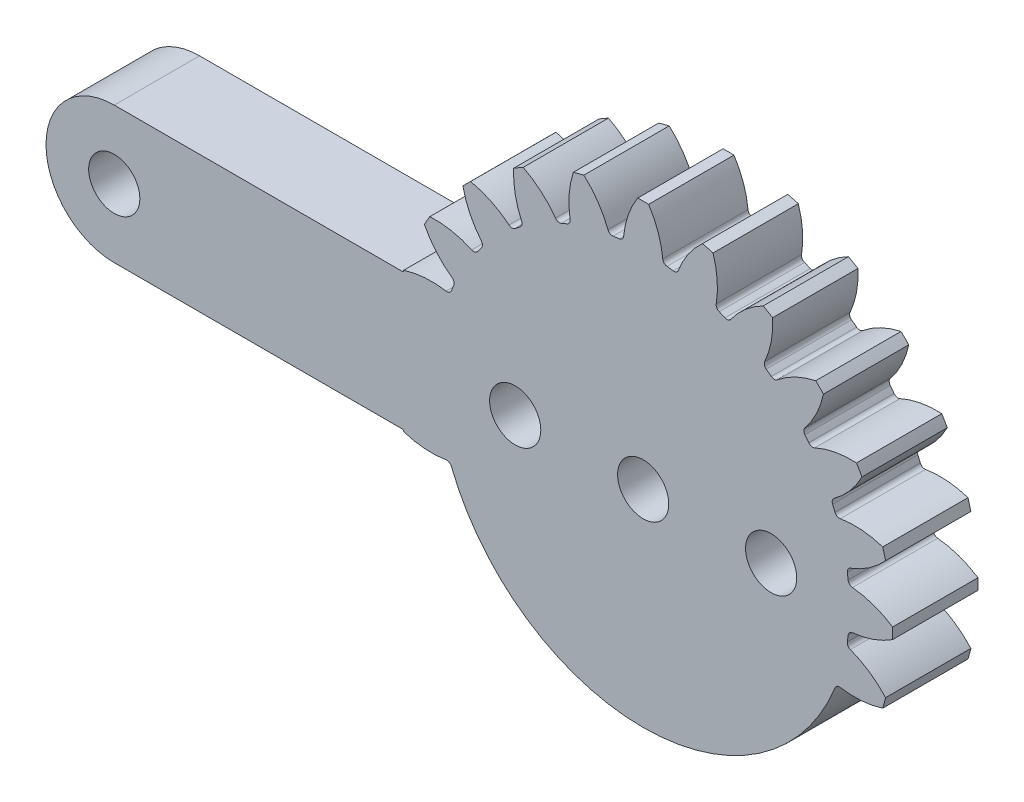
from build123d import *

# Parameters (mm, degrees)
SKETCH_1_R                       = 12.09375
SKETCH_1_R_2                     = 1.5
EXTRUDE_2_DEPTH                  = 5
EXTRUDE_3_DEPTH                  = 5
FILLET_2_R                       = 0.28125
PATTERN_CIRCULAR_1_COUNT         = 24
FILLET_2_OF_PATTERN_CIRCULAR_1_R = 0.28125
EXTRUDE_START                    = -5
SKETCH_2_R                       = 1.5
EXTRUDE_4_DEPTH                  = 5
CUT_EXTRUDE_1_DEPTH              = 5
CUT_EXTRUDE_1_DEPTH_BACK         = 39.260823775
CUT_EXTRUDE_2_REACH              = 40.261
SKETCH_4_R                       = 1.5


with BuildPart() as part:
    # 스케치1 → 보스-돌출2 (new body)
    with BuildSketch(Plane.XY):
        Circle(SKETCH_1_R)
        Circle(SKETCH_1_R_2, mode=Mode.SUBTRACT)
    extrude(amount=EXTRUDE_2_DEPTH)

    # 스케치1<4> → 보스-돌출3 (add)
    with BuildSketch(Plane.XY):
        with BuildLine():
            ThreePointArc((1.164375, 12.037567027), (0.912091491, 13.384904266), (0.320625, 14.621485034))
            ThreePointArc((0.320625, 14.621485034), (0, 14.625), (-0.320625, 14.621485034))
            ThreePointArc((-0.320625, 14.621485034), (-0.912091491, 13.384904266), (-1.164375, 12.037567027))
            ThreePointArc((-1.164375, 12.037567027), (0, 12.09375), (1.164375, 12.037567027))
        make_face()
    extrude_3 = extrude(amount=EXTRUDE_3_DEPTH)

    # 필렛2
    fillet_2_edges = [part.edges().sort_by_distance(p)[0] for p in [
        (-1.164375, 12.037567027, 2.5),
        (1.164375, 12.037567027, 2.5),
    ]]
    fillet(fillet_2_edges, radius=FILLET_2_R)

    # 원형 패턴1: 보스-돌출3 ×24 about axis
    pattern_circular_1_axis = Axis((0, 0, 0), (0, 0, 1))
    for i in range(1, PATTERN_CIRCULAR_1_COUNT):
        add(extrude_3.rotate(pattern_circular_1_axis, i * 360 / PATTERN_CIRCULAR_1_COUNT))

    # 필렛2 of 원형 패턴1
    fillet_2_of_pattern_circular_1_edges = [part.edges().sort_by_distance(p)[0] for p in [
        (-4.240251487, 11.326034451, 2.5),
        (-1.990851719, 11.928759302, 2.5),
        (-7.027161843, 9.842651345, 2.5),
        (-5.010405184, 11.007026345, 2.5),
        (-9.335182732, 7.688507815, 2.5),
        (-7.688507815, 9.335182732, 2.5),
        (-11.007026345, 5.010405184, 2.5),
        (-9.842651345, 7.027161843, 2.5),
        (-11.928759302, 1.990851719, 2.5),
        (-11.326034451, 4.240251487, 2.5),
        (-12.037567027, -1.164375, 2.5),
        (-12.037567027, 1.164375, 2.5),
        (-11.326034451, -4.240251487, 2.5),
        (-11.928759302, -1.990851719, 2.5),
        (-9.842651345, -7.027161843, 2.5),
        (-11.007026345, -5.010405184, 2.5),
        (-7.688507815, -9.335182732, 2.5),
        (-9.335182732, -7.688507815, 2.5),
        (-5.010405184, -11.007026345, 2.5),
        (-7.027161843, -9.842651345, 2.5),
        (-1.990851719, -11.928759302, 2.5),
        (-4.240251487, -11.326034451, 2.5),
        (1.164375, -12.037567027, 2.5),
        (-1.164375, -12.037567027, 2.5),
        (4.240251487, -11.326034451, 2.5),
        (1.990851719, -11.928759302, 2.5),
        (7.027161843, -9.842651345, 2.5),
        (5.010405184, -11.007026345, 2.5),
        (9.335182732, -7.688507815, 2.5),
        (7.688507815, -9.335182732, 2.5),
        (11.007026345, -5.010405184, 2.5),
        (9.842651345, -7.027161843, 2.5),
        (11.928759302, -1.990851719, 2.5),
        (11.326034451, -4.240251487, 2.5),
        (12.037567027, 1.164375, 2.5),
        (12.037567027, -1.164375, 2.5),
        (11.326034451, 4.240251487, 2.5),
        (11.928759302, 1.990851719, 2.5),
        (9.842651345, 7.027161843, 2.5),
        (11.007026345, 5.010405184, 2.5),
        (7.688507815, 9.335182732, 2.5),
        (9.335182732, 7.688507815, 2.5),
        (5.010405184, 11.007026345, 2.5),
        (7.027161843, 9.842651345, 2.5),
        (1.990851719, 11.928759302, 2.5),
        (4.240251487, 11.326034451, 2.5),
    ]]
    fillet(fillet_2_of_pattern_circular_1_edges, radius=FILLET_2_OF_PATTERN_CIRCULAR_1_R)

    # 스케치2 → 보스-돌출4 (add)
    with BuildSketch(Plane.XY.offset(5).offset(EXTRUDE_START)):
        with BuildLine():
            Line((0, -4), (-31, -4))
            ThreePointArc((-31, -4), (-35, 0), (-31, 4))
            Line((-31, 4), (0, 4))
            ThreePointArc((0, 4), (4, 0), (0, -4))
        make_face()
        with Locations((-31, 0)):
            Circle(SKETCH_2_R, mode=Mode.SUBTRACT)
        Circle(SKETCH_2_R, mode=Mode.SUBTRACT)
    extrude(amount=EXTRUDE_4_DEPTH)

    # 스케치3 → 컷-돌출-얇게1 (cut, two sides: drawn at the far end of the back side and taken through both)
    with BuildSketch(Plane.XY.offset(5).offset(-CUT_EXTRUDE_1_DEPTH_BACK)):
        with BuildLine():
            ThreePointArc((-11.173168096, -4.62807776), (-0.020278233, -12.093732999), (11.157585003, -4.665520973))
            Line((11.157585003, -4.665520973), (20.383495084, -8.523316093))
            ThreePointArc((20.383495084, -8.523316093), (-0.037045765, -22.093718942), (-20.411963421, -8.454912084))
            Line((-20.411963421, -8.454912084), (-11.173168096, -4.62807776))
        make_face()
    extrude(amount=CUT_EXTRUDE_1_DEPTH + CUT_EXTRUDE_1_DEPTH_BACK, mode=Mode.SUBTRACT)

    # 스케치4 → 컷-돌출2 (cut, up to next)
    with BuildSketch(Plane.XY.offset(5), mode=Mode.PRIVATE) as cut_extrude_2_sk1:
        with Locations((7.5, 0)):
            Circle(SKETCH_4_R)
    cut_extrude_2_tool1 = extrude(cut_extrude_2_sk1.sketch, amount=-CUT_EXTRUDE_2_REACH, mode=Mode.PRIVATE) & part.part
    # 스케치4 → 컷-돌출2 (cut, up to next)
    with BuildSketch(Plane.XY.offset(5), mode=Mode.PRIVATE) as cut_extrude_2_sk2:
        with Locations((-7.5, 0)):
            Circle(SKETCH_4_R)
    cut_extrude_2_tool2 = extrude(cut_extrude_2_sk2.sketch, amount=-CUT_EXTRUDE_2_REACH, mode=Mode.PRIVATE) & part.part
    add(cut_extrude_2_tool1.solids().sort_by_distance((7.5, 0, 5))[0], mode=Mode.SUBTRACT)
    add(cut_extrude_2_tool2.solids().sort_by_distance((-7.5, 0, 5))[0], mode=Mode.SUBTRACT)


solid = part.part
